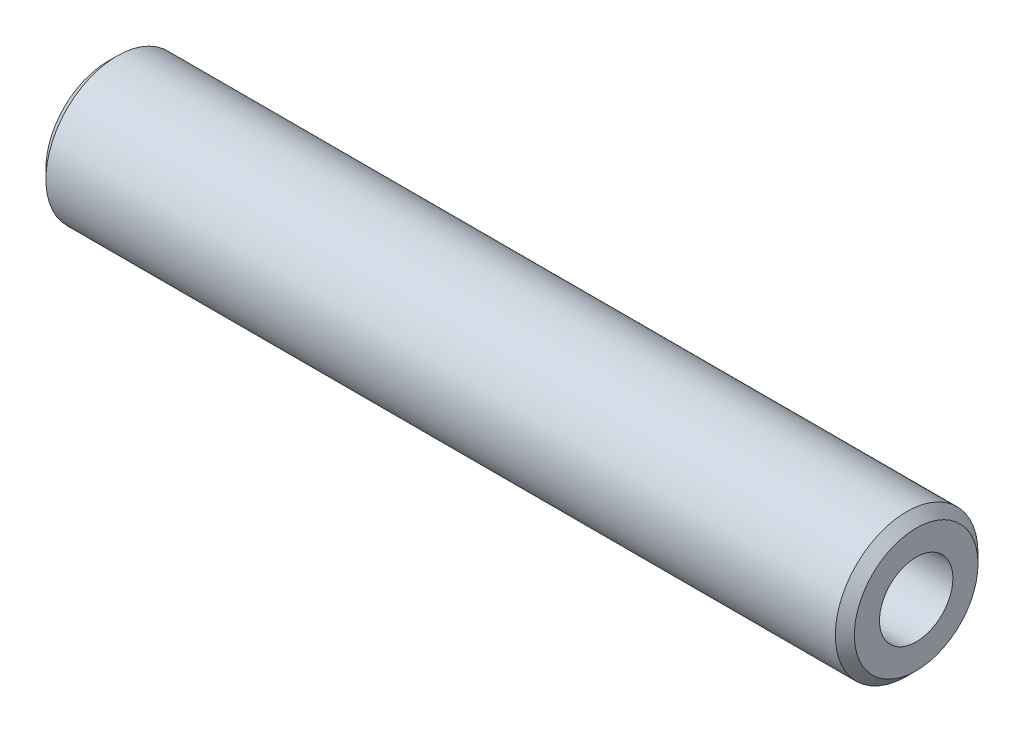
from build123d import *

# Parameters (mm, degrees)
SKETCH1_R           = 9.525
SKETCH1_R_2         = 4.9022
BOSS_EXTRUDE1_DEPTH = 107.95
CHAMFER1_SIZE       = 1.27


with BuildPart() as part:
    # Sketch1 → Boss-Extrude1 (new body)
    with BuildSketch(Plane(origin=(0, 0, 0), x_dir=(0, 0, -1), z_dir=(1, 0, 0))):
        Circle(SKETCH1_R)
        Circle(SKETCH1_R_2, mode=Mode.SUBTRACT)
    extrude(amount=BOSS_EXTRUDE1_DEPTH)

    # Chamfer1
    chamfer1_edges = [part.edges().sort_by_distance(p)[0] for p in [
        (0, 0, 9.525),
        (107.95, 0, 9.525),
    ]]
    chamfer(chamfer1_edges, length=CHAMFER1_SIZE)


solid = part.part
